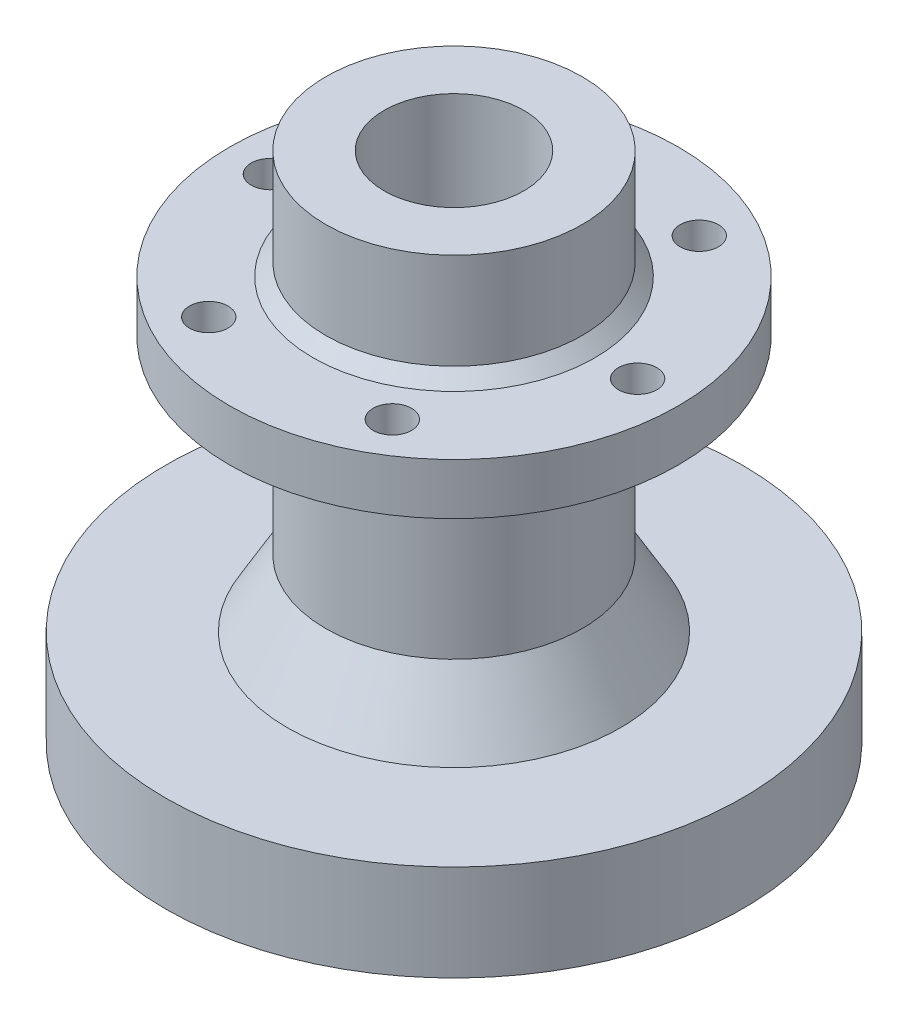
from build123d import *

# Parameters (mm, degrees)
SKETCH_1_R          = 45
EXTRUDE_1_DEPTH     = 15
SKETCH_2_R          = 20
EXTRUDE_2_DEPTH     = 65
SKETCH_4_R          = 10.9
CUT_EXTRUDE_4_DEPTH = 52
EXTRUDE_START       = 8
SKETCH_5_R          = 35
SKETCH_5_R_2        = 10.9
EXTRUDE_5_DEPTH     = 8
CHAMFER_3_SIZE      = 2
CHAMFER_4_SIZE      = 6
CHAMFER_4_SIZE2     = 10.392304845
SKETCH_6_R          = 7
CUT_EXTRUDE_8_DEPTH = 4
CUT_EXTRUDE_1_REACH = 91.549
SKETCH_7_R          = 3


with BuildPart() as part:
    # Эскиз1 → Вытянуть1 (new body)
    with BuildSketch(Plane(origin=(0, 0, 0), x_dir=(1, 0, 0), z_dir=(0, 1, 0))):
        with Locations(Location((0, 0, 0), (0, 0, 270))):
            Circle(SKETCH_1_R)
        with BuildLine():
            Line((-2, -6.708203932), (-2, -8.85))
            Line((-2, -8.85), (2.5, -8.85))
            Line((2.5, -8.85), (2.5, -6.538348415))
            ThreePointArc((2.5, -6.538348415), (-0.264031673, 6.995018747), (-2, -6.708203932))
        make_face(mode=Mode.SUBTRACT)
    extrude(amount=EXTRUDE_1_DEPTH)

    # Эскиз2 → Вытянуть2 (add)
    with BuildSketch(Plane(origin=(0, 15, 0), x_dir=(1, 0, 0), z_dir=(0, 1, 0))):
        with Locations(Location((0, 0, 0), (0, 0, 270))):
            Circle(SKETCH_2_R)
    extrude(amount=EXTRUDE_2_DEPTH)

    # Эскиз4 → Вытянуть4 (cut)
    with BuildSketch(Plane(origin=(0, 80, 0), x_dir=(1, 0, 0), z_dir=(0, 1, 0))):
        with Locations(Location((0, 0, 0), (0, 0, 270))):
            Circle(SKETCH_4_R)
    extrude(amount=-CUT_EXTRUDE_4_DEPTH, mode=Mode.SUBTRACT)

    # Эскиз5 → Вытянуть5 (add)
    with BuildSketch(Plane(origin=(0, 55, 0), x_dir=(-1, 0, 0), z_dir=(0, 1, 0)).offset(EXTRUDE_START)):
        with Locations(Location((0, 0, 0), (0, 0, 90))):
            Circle(SKETCH_5_R)
        with Locations(Location((0, 0, 0), (0, 0, 90))):
            Circle(SKETCH_5_R_2, mode=Mode.SUBTRACT)
    extrude(amount=-EXTRUDE_5_DEPTH)

    # Фаска3
    chamfer_3_edges = [part.edges().sort_by_distance(p)[0] for p in [
        (0, 55, -20),
        (0, 63, -20),
    ]]
    chamfer(chamfer_3_edges, length=CHAMFER_3_SIZE)

    # Фаска4
    chamfer_4_edges = [part.edges().sort_by_distance(p)[0] for p in [
        (0, 15, -20),
    ]]
    chamfer_4_side = [part.faces().sort_by_distance(p)[0] for p in [
        (0, 15, -43.727207794),
    ]]
    chamfer(chamfer_4_edges, length=CHAMFER_4_SIZE, length2=CHAMFER_4_SIZE2, reference=chamfer_4_side[0])

    # Эскиз6 → Вытянуть8 (cut)
    with BuildSketch(Plane.XZ.offset(-15)):
        with Locations(Location((0, 0, 0), (0, 0, 270))):
            Circle(SKETCH_6_R)
    extrude(amount=-CUT_EXTRUDE_8_DEPTH, mode=Mode.SUBTRACT)

    # Эскиз7 → Вырез-Вытянуть1 (cut, up to next)
    with BuildSketch(Plane(origin=(0, 63, 0), x_dir=(1, 0, 0), z_dir=(0, 1, 0)), mode=Mode.PRIVATE) as cut_extrude_1_sk1:
        with Locations(Location((-28.154160791, -0.499908421, 0), (0, 0, 270))):
            Circle(SKETCH_7_R)
    cut_extrude_1_tool1 = extrude(cut_extrude_1_sk1.sketch, amount=-CUT_EXTRUDE_1_REACH, mode=Mode.PRIVATE) & part.part
    # Эскиз7 → Вырез-Вытянуть1 (cut, up to next)
    with BuildSketch(Plane(origin=(0, 63, 0), x_dir=(1, 0, 0), z_dir=(0, 1, 0)), mode=Mode.PRIVATE) as cut_extrude_1_sk2:
        with Locations(Location((-14.510013788, 24.132264256, 0), (0, 0, 270))):
            Circle(SKETCH_7_R)
    cut_extrude_1_tool2 = extrude(cut_extrude_1_sk2.sketch, amount=-CUT_EXTRUDE_1_REACH, mode=Mode.PRIVATE) & part.part
    # Эскиз7 → Вырез-Вытянуть1 (cut, up to next)
    with BuildSketch(Plane(origin=(0, 63, 0), x_dir=(1, 0, 0), z_dir=(0, 1, 0)), mode=Mode.PRIVATE) as cut_extrude_1_sk3:
        with Locations(Location((13.644147003, 24.632172678, 0), (0, 0, 270))):
            Circle(SKETCH_7_R)
    cut_extrude_1_tool3 = extrude(cut_extrude_1_sk3.sketch, amount=-CUT_EXTRUDE_1_REACH, mode=Mode.PRIVATE) & part.part
    # Эскиз7 → Вырез-Вытянуть1 (cut, up to next)
    with BuildSketch(Plane(origin=(0, 63, 0), x_dir=(1, 0, 0), z_dir=(0, 1, 0)), mode=Mode.PRIVATE) as cut_extrude_1_sk4:
        with Locations(Location((28.154160791, 0.499908421, 0), (0, 0, 270))):
            Circle(SKETCH_7_R)
    cut_extrude_1_tool4 = extrude(cut_extrude_1_sk4.sketch, amount=-CUT_EXTRUDE_1_REACH, mode=Mode.PRIVATE) & part.part
    # Эскиз7 → Вырез-Вытянуть1 (cut, up to next)
    with BuildSketch(Plane(origin=(0, 63, 0), x_dir=(1, 0, 0), z_dir=(0, 1, 0)), mode=Mode.PRIVATE) as cut_extrude_1_sk5:
        with Locations(Location((14.510013788, -24.132264256, 0), (0, 0, 270))):
            Circle(SKETCH_7_R)
    cut_extrude_1_tool5 = extrude(cut_extrude_1_sk5.sketch, amount=-CUT_EXTRUDE_1_REACH, mode=Mode.PRIVATE) & part.part
    # Эскиз7 → Вырез-Вытянуть1 (cut, up to next)
    with BuildSketch(Plane(origin=(0, 63, 0), x_dir=(1, 0, 0), z_dir=(0, 1, 0)), mode=Mode.PRIVATE) as cut_extrude_1_sk6:
        with Locations(Location((-13.644147003, -24.632172678, 0), (0, 0, 270))):
            Circle(SKETCH_7_R)
    cut_extrude_1_tool6 = extrude(cut_extrude_1_sk6.sketch, amount=-CUT_EXTRUDE_1_REACH, mode=Mode.PRIVATE) & part.part
    add(cut_extrude_1_tool1.solids().sort_by_distance((-28.154161, 63, 0.499908))[0], mode=Mode.SUBTRACT)
    add(cut_extrude_1_tool2.solids().sort_by_distance((-14.510014, 63, -24.132264))[0], mode=Mode.SUBTRACT)
    add(cut_extrude_1_tool3.solids().sort_by_distance((13.644147, 63, -24.632173))[0], mode=Mode.SUBTRACT)
    add(cut_extrude_1_tool4.solids().sort_by_distance((28.154161, 63, -0.499908))[0], mode=Mode.SUBTRACT)
    add(cut_extrude_1_tool5.solids().sort_by_distance((14.510014, 63, 24.132264))[0], mode=Mode.SUBTRACT)
    add(cut_extrude_1_tool6.solids().sort_by_distance((-13.644147, 63, 24.632173))[0], mode=Mode.SUBTRACT)


solid = part.part
